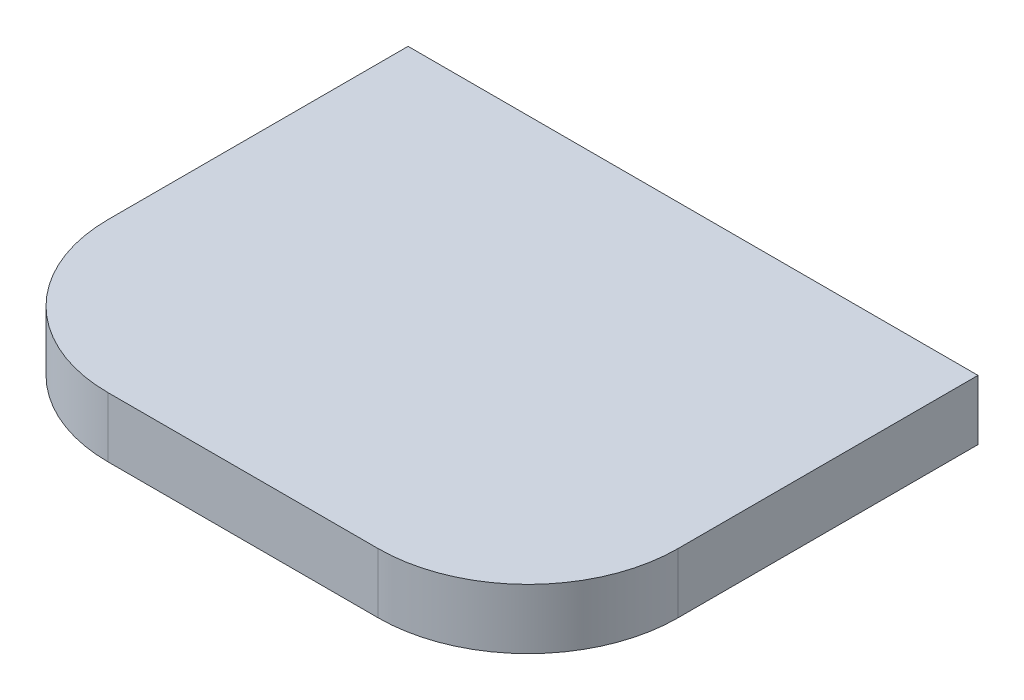
from build123d import *

# Parameters (mm, degrees)
SALIENTE_EXTRUIR1_DEPTH = 4


with BuildPart() as part:
    # Croquis2 → Saliente-Extruir1 (new body)
    with BuildSketch(Plane(origin=(0, 0, 0), x_dir=(1, 0, 0), z_dir=(0, 1, 0))):
        with BuildLine():
            Line((-43.107082341, -17.625158928), (-5.107082341, -17.625158928))
            Line((-5.107082341, -17.625158928), (-5.107082341, -37.625158928))
            ThreePointArc((-5.107082341, -37.625158928), (-8.036014529, -44.69622674), (-15.107082341, -47.625158928))
            Line((-15.107082341, -47.625158928), (-33.107082341, -47.625158928))
            ThreePointArc((-33.107082341, -47.625158928), (-40.178150153, -44.69622674), (-43.107082341, -37.625158928))
            Line((-43.107082341, -37.625158928), (-43.107082341, -17.625158928))
        make_face()
    extrude(amount=SALIENTE_EXTRUIR1_DEPTH)


solid = part.part
